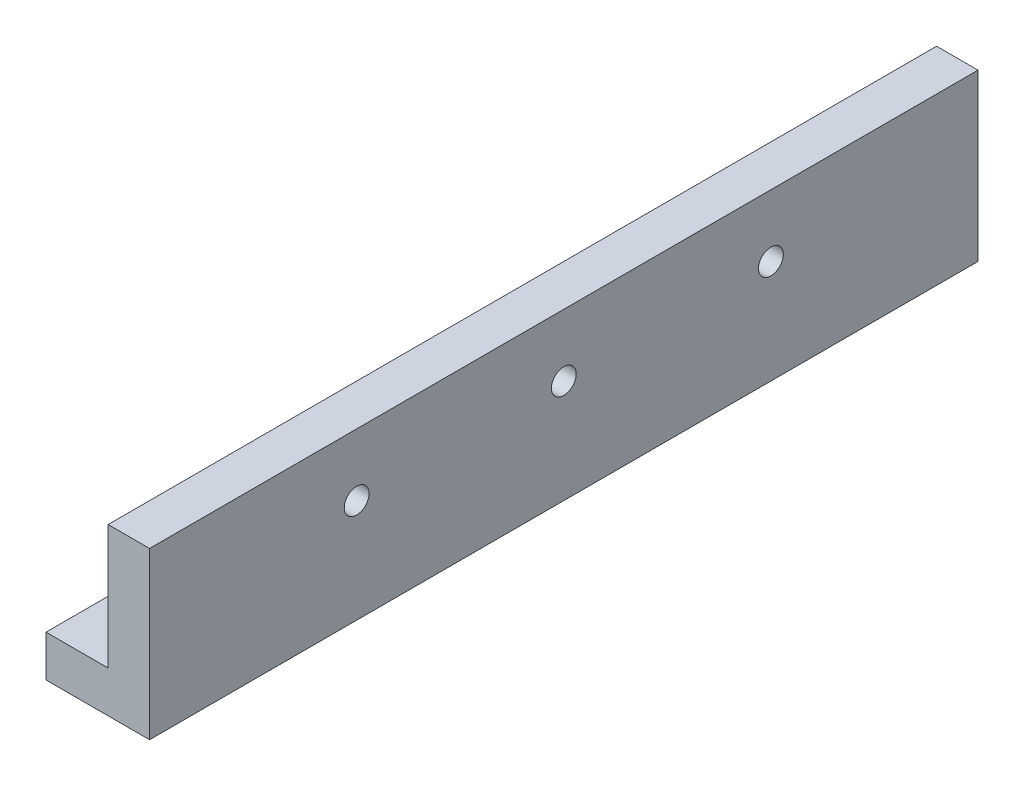
from build123d import *

# Parameters (mm, degrees)
EXTRUDE_1_DEPTH     = 200
CUT_EXTRUDE_START   = -10
SKETCH_2_R          = 3
CUT_EXTRUDE_1_DEPTH = 289.210954711
LPATTERN1_COUNT     = 3
LPATTERN1_PITCH     = 50


with BuildPart() as part:
    # 草圖1 → 填料-伸長1 (new body)
    with BuildSketch(Plane.XY):
        Polygon((-5.338534676, 191.77157068), (-5.338534676, 161.77157068), (-20.338534676, 161.77157068), (-20.338534676, 151.77157068), (4.661465324, 151.77157068), (4.661465324, 191.77157068), align=None)
    extrude(amount=-EXTRUDE_1_DEPTH)

    # 草圖2 → 除料-伸長1 (cut)
    with BuildSketch(Plane(origin=(4.661465324, 0, 0), x_dir=(0, 0, -1), z_dir=(1, 0, 0)).offset(CUT_EXTRUDE_START)):
        with Locations(Location((150, 176.77157068, 0), (0, 0, 90))):
            Circle(SKETCH_2_R)
    cut_extrude_1 = extrude(amount=CUT_EXTRUDE_1_DEPTH, mode=Mode.SUBTRACT)

    # LPattern1: 除料-伸長1 ×3
    with Locations(*[(0, 0, i * LPATTERN1_PITCH) for i in range(1, LPATTERN1_COUNT)]):
        add(cut_extrude_1, mode=Mode.SUBTRACT)


solid = part.part
